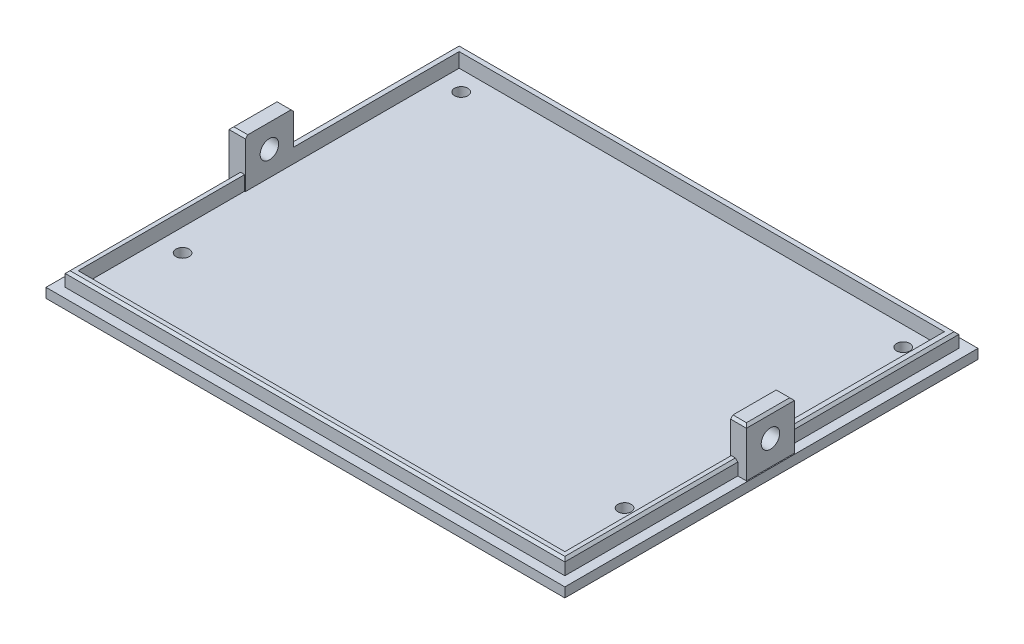
from build123d import *

# Parameters (mm, degrees)
SKETCH1_W                       = 108
SKETCH1_H                       = 86
BOSS_EXTRUDE1_DEPTH             = 2
SKETCH2_W                       = 104
SKETCH2_H                       = 82
SKETCH2_W_2                     = 101
SKETCH2_H_2                     = 79
BOSS_EXTRUDE2_DEPTH             = 3
BOSS_EXTRUDE4_REACH             = 138.591
SKETCH5_W                       = 10
SKETCH5_H                       = 10
BOSS_EXTRUDE4_DIRECTION_2_REACH = 138.591
BOSS_EXTRUDE5_REACH             = 139.026
SKETCH6_W                       = 10
SKETCH6_H                       = 10
BOSS_EXTRUDE5_DIRECTION_2_REACH = 139.026
SKETCH11_W                      = 0.1
SKETCH11_H                      = 10
SKETCH11_W_2                    = 0.2
CUT_EXTRUDE2_DEPTH              = 10
CHAMFER1_SIZE                   = 0.5
CHAMFER2_SIZE                   = 0.5
CUT_EXTRUDE3_REACH              = 140.578
SKETCH12_R                      = 1.375
CUT_EXTRUDE5_DEPTH              = 3
CUT_EXTRUDE6_REACH              = 140.501
SKETCH14_R                      = 1.925
CUT_EXTRUDE7_REACH              = 140.423
SKETCH15_R                      = 1.925


with BuildPart() as part:
    # Sketch1 → Boss-Extrude1 (new body)
    with BuildSketch(Plane(origin=(0, 0, 0), x_dir=(1, 0, 0), z_dir=(0, 1, 0))):
        with Locations((54, 43)):
            Rectangle(SKETCH1_W, SKETCH1_H)
    extrude(amount=BOSS_EXTRUDE1_DEPTH)

    # Sketch2 → Boss-Extrude2 (add)
    with BuildSketch(Plane(origin=(0, 2, 0), x_dir=(1, 0, 0), z_dir=(0, 1, 0))):
        with Locations((54, 43)):
            Rectangle(SKETCH2_W, SKETCH2_H)
        with Locations((54, 43)):
            Rectangle(SKETCH2_W_2, SKETCH2_H_2, mode=Mode.SUBTRACT)
    extrude(amount=BOSS_EXTRUDE2_DEPTH)

    # Boss-Extrude4: up to this face of the body (flat: up to its plane)
    boss_extrude4_end = Plane(part.part.faces().sort_by_distance((0, 1, -43))[0])
    # Sketch5 → Boss-Extrude4 (add, up to the picked face)
    with BuildSketch(Plane.ZY.offset(-2), mode=Mode.PRIVATE) as boss_extrude4_sk1:
        with Locations((-43, 7)):
            Rectangle(SKETCH5_W, SKETCH5_H)
    boss_extrude4_tool1 = split(extrude(boss_extrude4_sk1.sketch, amount=BOSS_EXTRUDE4_REACH, mode=Mode.PRIVATE), bisect_by=boss_extrude4_end, keep=Keep.BOTH, mode=Mode.PRIVATE)
    add(boss_extrude4_tool1.solids().sort_by(Axis((2, 7, -43), (-1, 0, 0)))[0])

    # Boss-Extrude4 direction 2: up to this face of the body (flat: up to its plane)
    boss_extrude4_direction_2_end = Plane(part.part.faces().sort_by_distance((3.5, 3.5, -43))[0])
    # Sketch5 → Boss-Extrude4 direction 2 (add, up to the picked face)
    with BuildSketch(Plane.ZY.offset(-2), mode=Mode.PRIVATE) as boss_extrude4_direction_2_sk1:
        with Locations((-43, 7)):
            Rectangle(SKETCH5_W, SKETCH5_H)
    boss_extrude4_direction_2_tool1 = split(extrude(boss_extrude4_direction_2_sk1.sketch, amount=-BOSS_EXTRUDE4_DIRECTION_2_REACH, mode=Mode.PRIVATE), bisect_by=boss_extrude4_direction_2_end, keep=Keep.BOTH, mode=Mode.PRIVATE)
    add(boss_extrude4_direction_2_tool1.solids().sort_by(Axis((2, 7, -43), (1, 0, 0)))[0])

    # Boss-Extrude5: up to this face of the body (flat: up to its plane)
    boss_extrude5_end = Plane(part.part.faces().sort_by_distance((108, 1, -43))[0])
    # Sketch6 → Boss-Extrude5 (add, up to the picked face)
    with BuildSketch(Plane(origin=(106, 0, 0), x_dir=(0, 0, -1), z_dir=(1, 0, 0)), mode=Mode.PRIVATE) as boss_extrude5_sk1:
        with Locations((43, 7)):
            Rectangle(SKETCH6_W, SKETCH6_H)
    boss_extrude5_tool1 = split(extrude(boss_extrude5_sk1.sketch, amount=BOSS_EXTRUDE5_REACH, mode=Mode.PRIVATE), bisect_by=boss_extrude5_end, keep=Keep.BOTH, mode=Mode.PRIVATE)
    add(boss_extrude5_tool1.solids().sort_by(Axis((106, 7, -43), (1, 0, 0)))[0])

    # Boss-Extrude5 direction 2: up to this face of the body (flat: up to its plane)
    boss_extrude5_direction_2_end = Plane(part.part.faces().sort_by_distance((104.5, 3.5, -43))[0])
    # Sketch6 → Boss-Extrude5 direction 2 (add, up to the picked face)
    with BuildSketch(Plane(origin=(106, 0, 0), x_dir=(0, 0, -1), z_dir=(1, 0, 0)), mode=Mode.PRIVATE) as boss_extrude5_direction_2_sk1:
        with Locations((43, 7)):
            Rectangle(SKETCH6_W, SKETCH6_H)
    boss_extrude5_direction_2_tool1 = split(extrude(boss_extrude5_direction_2_sk1.sketch, amount=-BOSS_EXTRUDE5_DIRECTION_2_REACH, mode=Mode.PRIVATE), bisect_by=boss_extrude5_direction_2_end, keep=Keep.BOTH, mode=Mode.PRIVATE)
    add(boss_extrude5_direction_2_tool1.solids().sort_by(Axis((106, 7, -43), (-1, 0, 0)))[0])

    # Sketch11 → Cut-Extrude2 (cut)
    with BuildSketch(Plane(origin=(0, 12, 0), x_dir=(1, 0, 0), z_dir=(0, 1, 0))):
        with Locations((0.05, 43)):
            Rectangle(SKETCH11_W, SKETCH11_H)
        with Locations((107.9, 43)):
            Rectangle(SKETCH11_W_2, SKETCH11_H)
    extrude(amount=-CUT_EXTRUDE2_DEPTH, mode=Mode.SUBTRACT)

    # Chamfer1
    chamfer1_edges = [part.edges().sort_by_distance(p)[0] for p in [
        (54, 5, -84),
        (2, 5, -66),
        (54, 5, -2),
        (106, 5, -20),
        (2, 5, -20),
        (106, 5, -66),
    ]]
    chamfer(chamfer1_edges, length=CHAMFER1_SIZE)

    # Chamfer2
    chamfer2_edges = [part.edges().sort_by_distance(p)[0] for p in [
        (106.15, 12, -38),
        (106.15, 12, -48),
        (1.8, 12, -48),
        (1.8, 12, -38),
        (0.1, 12, -43),
        (107.8, 12, -43),
    ]]
    chamfer(chamfer2_edges, length=CHAMFER2_SIZE)

    # Sketch12 → Cut-Extrude3 (cut, up to next)
    with BuildSketch(Plane.XZ, mode=Mode.PRIVATE) as cut_extrude3_sk1:
        with Locations(Location((100, -78.425, 0), (0, 0, 270))):
            Circle(SKETCH12_R)
    cut_extrude3_tool1 = extrude(cut_extrude3_sk1.sketch, amount=-CUT_EXTRUDE3_REACH, mode=Mode.PRIVATE) & part.part
    # Sketch12 → Cut-Extrude3 (cut, up to next)
    with BuildSketch(Plane.XZ, mode=Mode.PRIVATE) as cut_extrude3_sk2:
        with Locations(Location((8, -78.425, 0), (0, 0, 270))):
            Circle(SKETCH12_R)
    cut_extrude3_tool2 = extrude(cut_extrude3_sk2.sketch, amount=-CUT_EXTRUDE3_REACH, mode=Mode.PRIVATE) & part.part
    # Sketch12 → Cut-Extrude3 (cut, up to next)
    with BuildSketch(Plane.XZ, mode=Mode.PRIVATE) as cut_extrude3_sk3:
        with Locations(Location((8, -20.425, 0), (0, 0, 270))):
            Circle(SKETCH12_R)
    cut_extrude3_tool3 = extrude(cut_extrude3_sk3.sketch, amount=-CUT_EXTRUDE3_REACH, mode=Mode.PRIVATE) & part.part
    # Sketch12 → Cut-Extrude3 (cut, up to next)
    with BuildSketch(Plane.XZ, mode=Mode.PRIVATE) as cut_extrude3_sk4:
        with Locations(Location((100, -20.425, 0), (0, 0, 270))):
            Circle(SKETCH12_R)
    cut_extrude3_tool4 = extrude(cut_extrude3_sk4.sketch, amount=-CUT_EXTRUDE3_REACH, mode=Mode.PRIVATE) & part.part
    add(cut_extrude3_tool1.solids().sort_by_distance((100, 0, -78.425))[0], mode=Mode.SUBTRACT)
    add(cut_extrude3_tool2.solids().sort_by_distance((8, 0, -78.425))[0], mode=Mode.SUBTRACT)
    add(cut_extrude3_tool3.solids().sort_by_distance((8, 0, -20.425))[0], mode=Mode.SUBTRACT)
    add(cut_extrude3_tool4.solids().sort_by_distance((100, 0, -20.425))[0], mode=Mode.SUBTRACT)

    # Sketch13 → Cut-Extrude5 (cut)
    with BuildSketch(Plane(origin=(0, 5, 0), x_dir=(1, 0, 0), z_dir=(0, 1, 0))):
        Polygon((3.35, 38), (3.35, 3.35), (104.65, 3.35), (104.65, 38), (104.5, 38), (104.5, 3.5), (3.5, 3.5), (3.5, 38), align=None)
    extrude(amount=-CUT_EXTRUDE5_DEPTH, mode=Mode.SUBTRACT)

    # Sketch14 → Cut-Extrude6 (cut, up to next)
    with BuildSketch(Plane.ZY.offset(-0.1), mode=Mode.PRIVATE) as cut_extrude6_sk1:
        with Locations((-43, 7.15)):
            Circle(SKETCH14_R)
    cut_extrude6_tool1 = extrude(cut_extrude6_sk1.sketch, amount=-CUT_EXTRUDE6_REACH, mode=Mode.PRIVATE) & part.part
    add(cut_extrude6_tool1.solids().sort_by_distance((0.1, 7.15, -43))[0], mode=Mode.SUBTRACT)

    # Sketch15 → Cut-Extrude7 (cut, up to next)
    with BuildSketch(Plane(origin=(107.8, 0, 0), x_dir=(0, 0, -1), z_dir=(1, 0, 0)), mode=Mode.PRIVATE) as cut_extrude7_sk1:
        with Locations(Location((43, 7.15, 0), (0, 0, 180))):
            Circle(SKETCH15_R)
    cut_extrude7_tool1 = extrude(cut_extrude7_sk1.sketch, amount=-CUT_EXTRUDE7_REACH, mode=Mode.PRIVATE) & part.part
    add(cut_extrude7_tool1.solids().sort_by_distance((107.8, 7.15, -43))[0], mode=Mode.SUBTRACT)


solid = part.part
